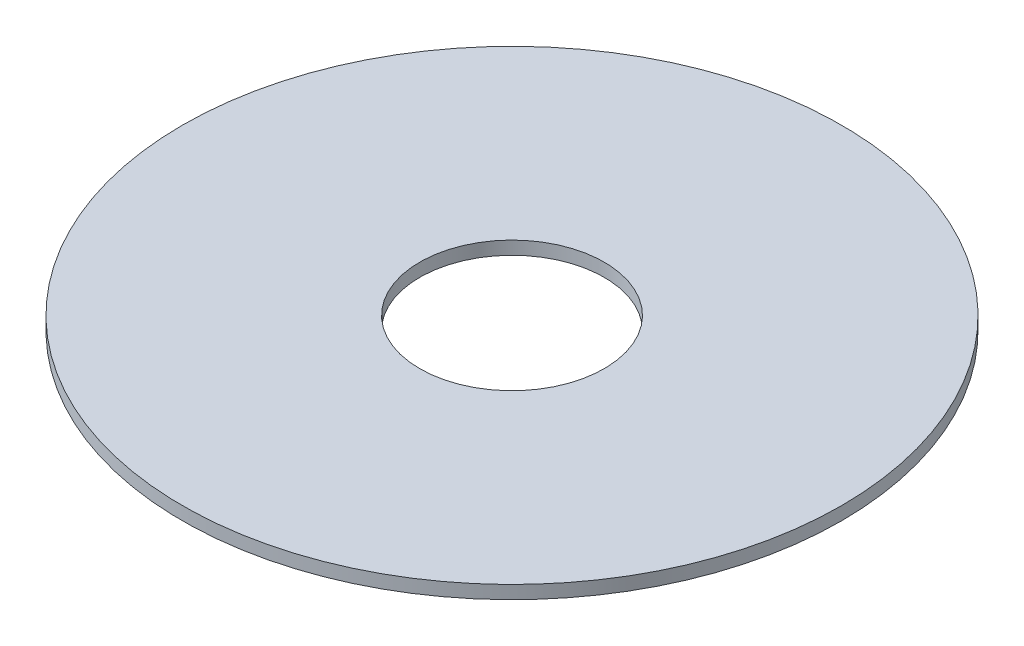
from build123d import *

# Parameters (mm, degrees)
SKETCH1_R           = 25
SKETCH1_R_2         = 7
EXTRUDE_THIN1_DEPTH = 1


with BuildPart() as part:
    # Sketch1 → Extrude-Thin1 (new body)
    with BuildSketch(Plane(origin=(0, 0, 0), x_dir=(1, 0, 0), z_dir=(0, 1, 0))):
        Circle(SKETCH1_R)
        Circle(SKETCH1_R_2, mode=Mode.SUBTRACT)
    extrude(amount=EXTRUDE_THIN1_DEPTH)


solid = part.part
